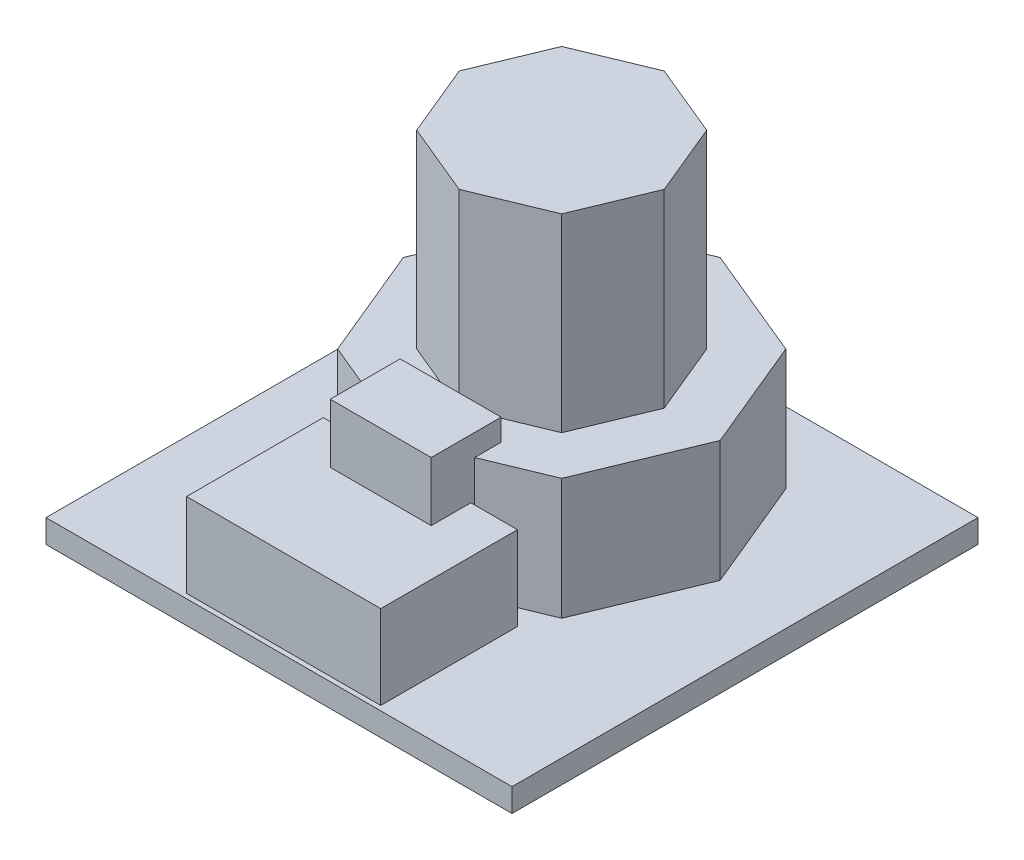
from build123d import *

# Parameters (mm, degrees)
SKETCH_1_W      = 300
SKETCH_1_H      = 300
EXTRUDE_1_DEPTH = 15
EXTRUDE_2_DEPTH = 78
EXTRUDE_3_DEPTH = 200
SKETCH_4_W      = 125
SKETCH_4_H      = 88
EXTRUDE_4_DEPTH = 54
SKETCH_5_W      = 65
SKETCH_5_H      = 45
EXTRUDE_5_DEPTH = 92


with BuildPart() as part:
    # 草图1 → 凸台-拉伸1 (new body)
    with BuildSketch(Plane(origin=(0, 0, 0), x_dir=(1, 0, 0), z_dir=(0, 1, 0))):
        Rectangle(SKETCH_1_W, SKETCH_1_H)
    extrude(amount=-EXTRUDE_1_DEPTH)

    # 草图2 → 凸台-拉伸2 (add)
    with BuildSketch(Plane(origin=(0, 0, 0), x_dir=(1, 0, 0), z_dir=(0, 1, 0))):
        Polygon((102, 32), (72.124891681, 104.124891681), (0, 134), (-72.124891681, 104.124891681), (-102, 32), (-72.124891681, -40.124891681), (0, -70), (72.124891681, -40.124891681), align=None)
    extrude(amount=EXTRUDE_2_DEPTH)

    # 草图3 → 凸台-拉伸3 (add)
    with BuildSketch(Plane(origin=(0, 0, 0), x_dir=(1, 0, 0), z_dir=(0, 1, 0))):
        Polygon((66, 32), (46.669047558, 78.669047558), (0, 98), (-46.669047558, 78.669047558), (-66, 32), (-46.669047558, -14.669047558), (0, -34), (46.669047558, -14.669047558), align=None)
    extrude(amount=EXTRUDE_3_DEPTH)

    # 草图4 → 凸台-拉伸4 (add)
    with BuildSketch(Plane(origin=(0, 0, 0), x_dir=(1, 0, 0), z_dir=(0, 1, 0))):
        with Locations((0, -103)):
            Rectangle(SKETCH_4_W, SKETCH_4_H)
    extrude(amount=EXTRUDE_4_DEPTH)

    # 草图5 → 凸台-拉伸5 (add)
    with BuildSketch(Plane(origin=(0, 0, 0), x_dir=(1, 0, 0), z_dir=(0, 1, 0))):
        with Locations((0, -62)):
            Rectangle(SKETCH_5_W, SKETCH_5_H)
    extrude(amount=EXTRUDE_5_DEPTH)


solid = part.part
